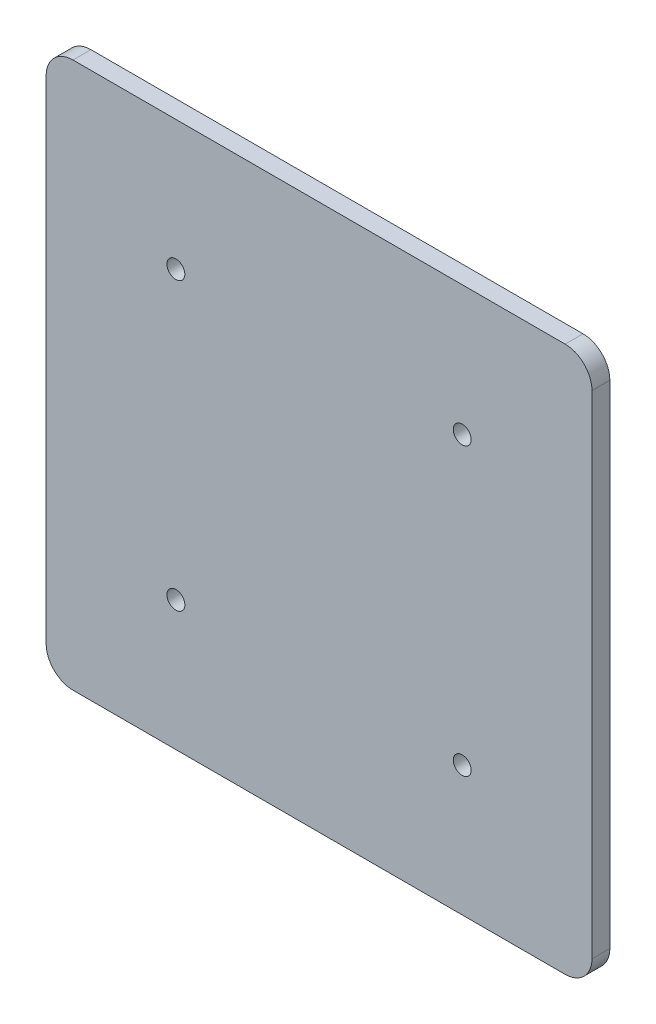
from build123d import *

# Parameters (mm, degrees)
ESQUISSE1_W              = 305
ESQUISSE1_H              = 305
BOSS_EXTRU_1_DEPTH       = 10
CONG_2_R                 = 15
ESQUISSE3_R              = 5
ENL_V_MAT_EXTRU_11_DEPTH = 10


with BuildPart() as part:
    # Esquisse1 → Boss.-Extru.1 (new body)
    with BuildSketch(Plane.XY):
        Rectangle(ESQUISSE1_W, ESQUISSE1_H)
    extrude(amount=BOSS_EXTRU_1_DEPTH)

    # Congé2
    cong_2_edges = [part.edges().sort_by_distance(p)[0] for p in [
        (-152.5, 152.5, 5),
        (152.5, 152.5, 5),
        (152.5, -152.5, 5),
        (-152.5, -152.5, 5),
    ]]
    fillet(cong_2_edges, radius=CONG_2_R)

    # Esquisse3 → Enlèv. mat.-Extru.11 (cut)
    with BuildSketch(Plane.XY.offset(10)):
        with Locations((80, 80)):
            Circle(ESQUISSE3_R)
        with Locations((80, -80)):
            Circle(ESQUISSE3_R)
        with Locations((-80, -80)):
            Circle(ESQUISSE3_R)
        with Locations((-80, 80)):
            Circle(ESQUISSE3_R)
    extrude(amount=-ENL_V_MAT_EXTRU_11_DEPTH, mode=Mode.SUBTRACT)


solid = part.part
